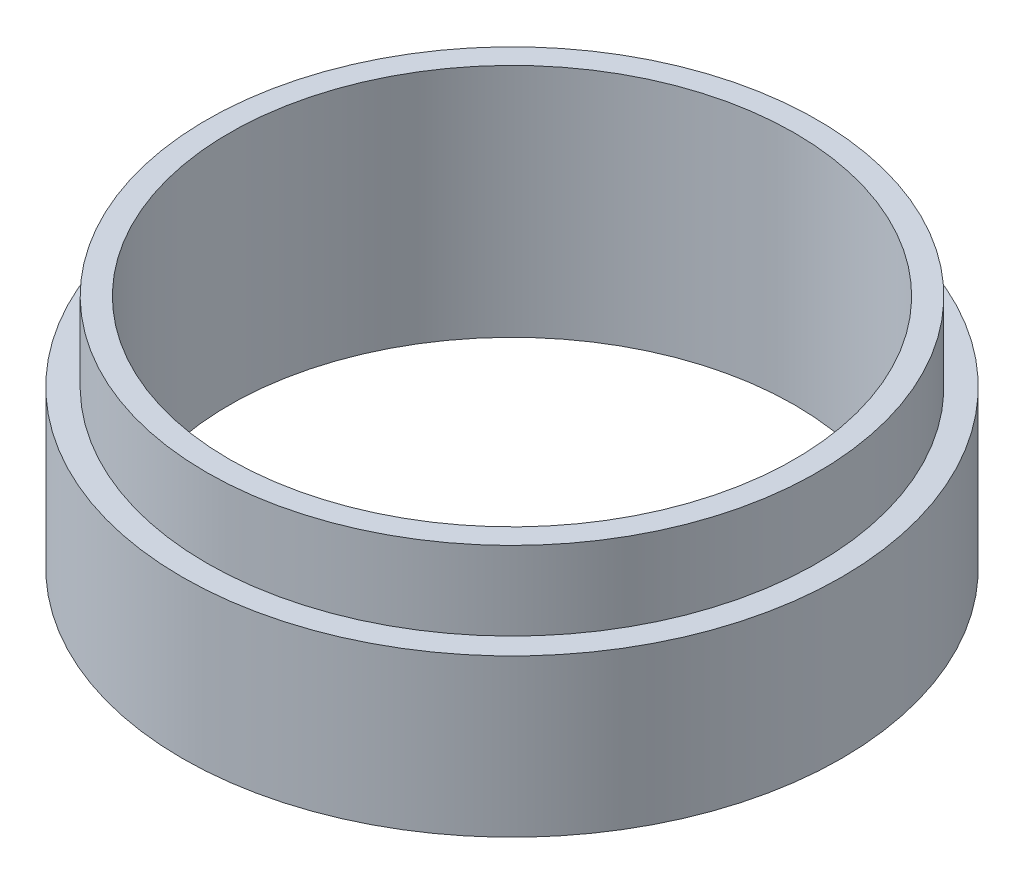
from build123d import *

# Parameters (mm, degrees)
SKETCH1_W           = 21
SKETCH1_H           = 10
SKETCH2_R           = 18
CUT_EXTRUDE1_DEPTH  = 32.336879232
SKETCH4_R           = 19.45
BOSS_EXTRUDE1_DEPTH = 5
SKETCH5_R           = 18
CUT_EXTRUDE2_DEPTH  = 34.271609519


with BuildPart() as part:
    # Sketch1 → Revolve1 (revolve)
    with BuildSketch(Plane.XY, mode=Mode.PRIVATE) as revolve1_sk:
        with Locations((10.5, 5)):
            Rectangle(SKETCH1_W, SKETCH1_H)
    revolve(revolve1_sk.sketch.rotate(Axis((0, 0, 0), (0, 1, 0)), 90), axis=Axis((0, 0, 0), (0, 1, 0)))

    # Sketch2 → Cut-Extrude1 (cut, through all)
    with BuildSketch(Plane(origin=(0, 10, 0), x_dir=(1, 0, 0), z_dir=(0, 1, 0))):
        with Locations(Location((0, 0, 0), (0, 0, 270))):
            Circle(SKETCH2_R)
    extrude(amount=-CUT_EXTRUDE1_DEPTH, mode=Mode.SUBTRACT)

    # Sketch4 → Boss-Extrude1 (add)
    with BuildSketch(Plane(origin=(0, 10, 0), x_dir=(1, 0, 0), z_dir=(0, 1, 0))):
        with Locations(Location((0, 0, 0), (0, 0, 270))):
            Circle(SKETCH4_R)
    extrude(amount=BOSS_EXTRUDE1_DEPTH)

    # Sketch5 → Cut-Extrude2 (cut, through all)
    with BuildSketch(Plane(origin=(0, 15, 0), x_dir=(1, 0, 0), z_dir=(0, 1, 0))):
        with Locations(Location((0, 0, 0), (0, 0, 270))):
            Circle(SKETCH5_R)
    extrude(amount=-CUT_EXTRUDE2_DEPTH, mode=Mode.SUBTRACT)


solid = part.part
